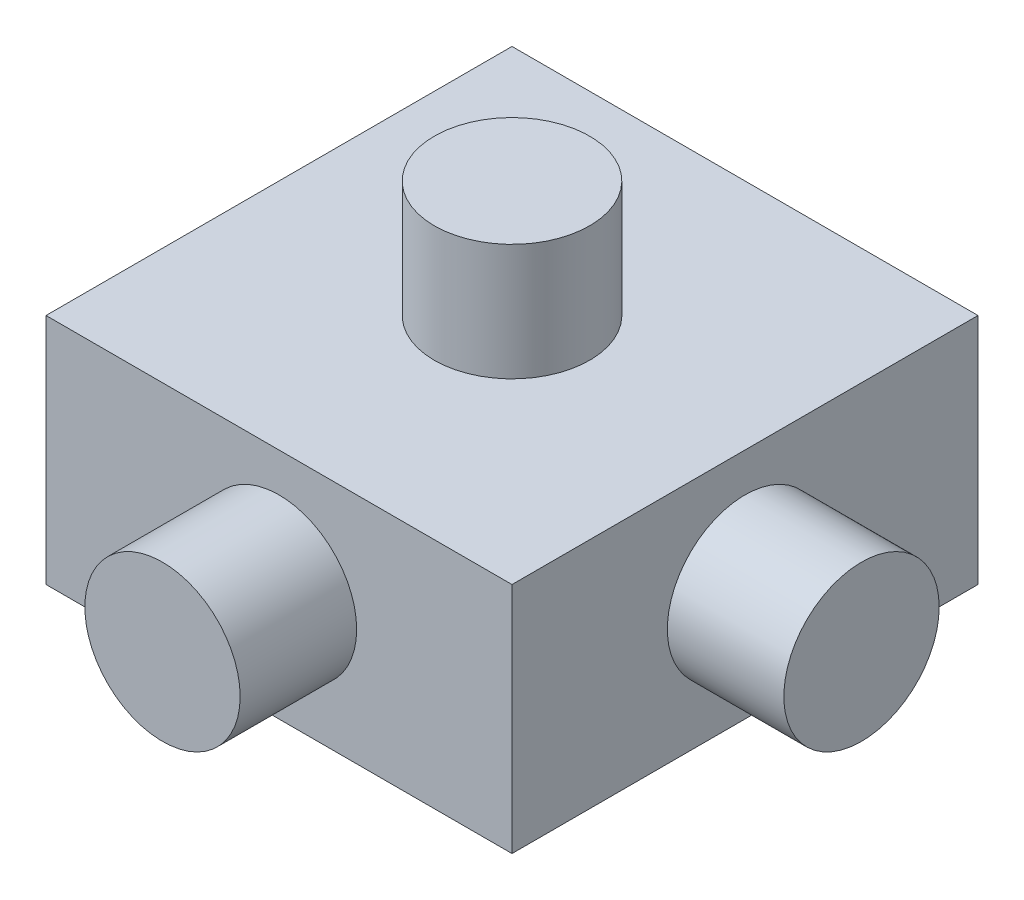
from build123d import *

# Parameters (mm, degrees)
SKETCH_1_W      = 60
SKETCH_1_H      = 60
EXTRUDE_1_DEPTH = 30
SKETCH_2_R      = 10
EXTRUDE_2_DEPTH = 15
SKETCH_4_R      = 10
EXTRUDE_3_DEPTH = 15
SKETCH_5_R      = 10
EXTRUDE_4_DEPTH = 15


with BuildPart() as part:
    # 스케치1 → 보스-돌출1 (new body)
    with BuildSketch(Plane(origin=(0, 0, 0), x_dir=(1, 0, 0), z_dir=(0, 1, 0))):
        with Locations((-12.687876758, 2.632618888)):
            Rectangle(SKETCH_1_W, SKETCH_1_H)
    extrude(amount=EXTRUDE_1_DEPTH)

    # 스케치2 → 보스-돌출2 (add)
    with BuildSketch(Plane(origin=(17.312123242, 0, 0), x_dir=(0, 0, -1), z_dir=(1, 0, 0))):
        with Locations((2.632618888, 15)):
            Circle(SKETCH_2_R)
    extrude(amount=EXTRUDE_2_DEPTH)

    # 스케치4 → 보스-돌출3 (add)
    with BuildSketch(Plane.XY.offset(27.367381112)):
        with Locations((-12.687876758, 15)):
            Circle(SKETCH_4_R)
    extrude(amount=EXTRUDE_3_DEPTH)

    # 스케치5 → 보스-돌출4 (add)
    with BuildSketch(Plane(origin=(0, 30, 0), x_dir=(1, 0, 0), z_dir=(0, 1, 0))):
        with Locations(Location((-12.687876758, 2.632618888, 0), (0, 0, 270))):
            Circle(SKETCH_5_R)
    extrude(amount=EXTRUDE_4_DEPTH)


solid = part.part
